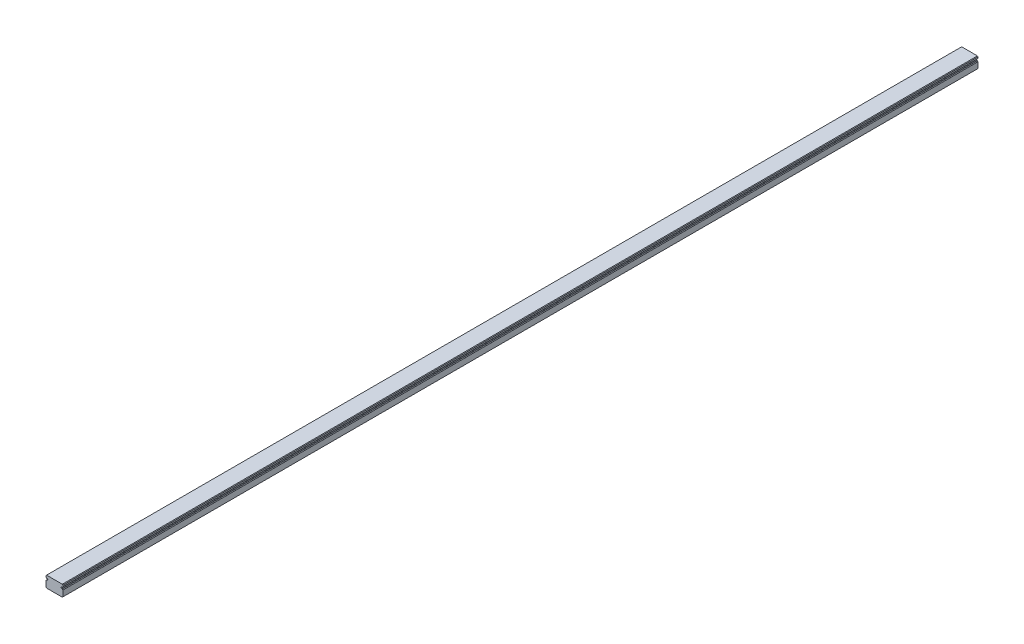
from build123d import *

# Parameters (mm, degrees)
EXTRUDE_289_DEPTH = 325


with BuildPart() as part:
    # Model → Extrude 289 (new, symmetric)
    with BuildSketch(Plane.XY):
        with BuildLine():
            Line((-6.000000002, -3.626884426), (-5.600000002, -4.026884426))
            Line((-5.600000002, -4.026884426), (5.600000002, -4.026884426))
            Line((5.600000002, -4.026884426), (6.000000002, -3.626884426))
            Line((6.000000002, -3.626884426), (6.000000002, 0.573115576))
            Line((6.000000002, 0.573115576), (5.962717201, 0.614126657))
            ThreePointArc((5.962717201, 0.614126657), (5.710750701, 0.74262912), (5.606772215, 1.005666141))
            Line((5.606772215, 1.005666141), (5.500000002, 1.123115576))
            Line((5.500000002, 1.123115576), (5.200000002, 1.123115576))
            ThreePointArc((5.200000002, 1.123115576), (4.750000002, 1.573115576), (5.200000002, 2.023115576))
            Line((5.200000002, 2.023115576), (5.500000002, 2.023115576))
            Line((5.500000002, 2.023115576), (5.606772215, 2.140565011))
            ThreePointArc((5.606772215, 2.140565011), (5.710750701, 2.403602032), (5.962717201, 2.532104495))
            Line((5.962717201, 2.532104495), (6.000000002, 2.573115576))
            Line((6.000000002, 2.573115576), (6.000000002, 3.573115577))
            Line((6.000000002, 3.573115577), (5.600000002, 3.973115577))
            Line((5.600000002, 3.973115577), (-5.600000002, 3.973115577))
            Line((-5.600000002, 3.973115577), (-6.000000002, 3.573115577))
            Line((-6.000000002, 3.573115577), (-6.000000002, 2.573115576))
            Line((-6.000000002, 2.573115576), (-5.962717201, 2.532104495))
            ThreePointArc((-5.962717201, 2.532104495), (-5.710750701, 2.403602032), (-5.606772215, 2.140565011))
            Line((-5.606772215, 2.140565011), (-5.500000002, 2.023115576))
            Line((-5.500000002, 2.023115576), (-5.200000002, 2.023115576))
            ThreePointArc((-5.200000002, 2.023115576), (-4.750000002, 1.573115576), (-5.200000002, 1.123115576))
            Line((-5.200000002, 1.123115576), (-5.500000002, 1.123115576))
            Line((-5.500000002, 1.123115576), (-5.606772215, 1.005666141))
            ThreePointArc((-5.606772215, 1.005666141), (-5.710750701, 0.74262912), (-5.962717201, 0.614126657))
            Line((-5.962717201, 0.614126657), (-6.000000002, 0.573115576))
            Line((-6.000000002, 0.573115576), (-6.000000002, -3.626884426))
        make_face()
    extrude(amount=EXTRUDE_289_DEPTH, both=True)


solid = part.part
